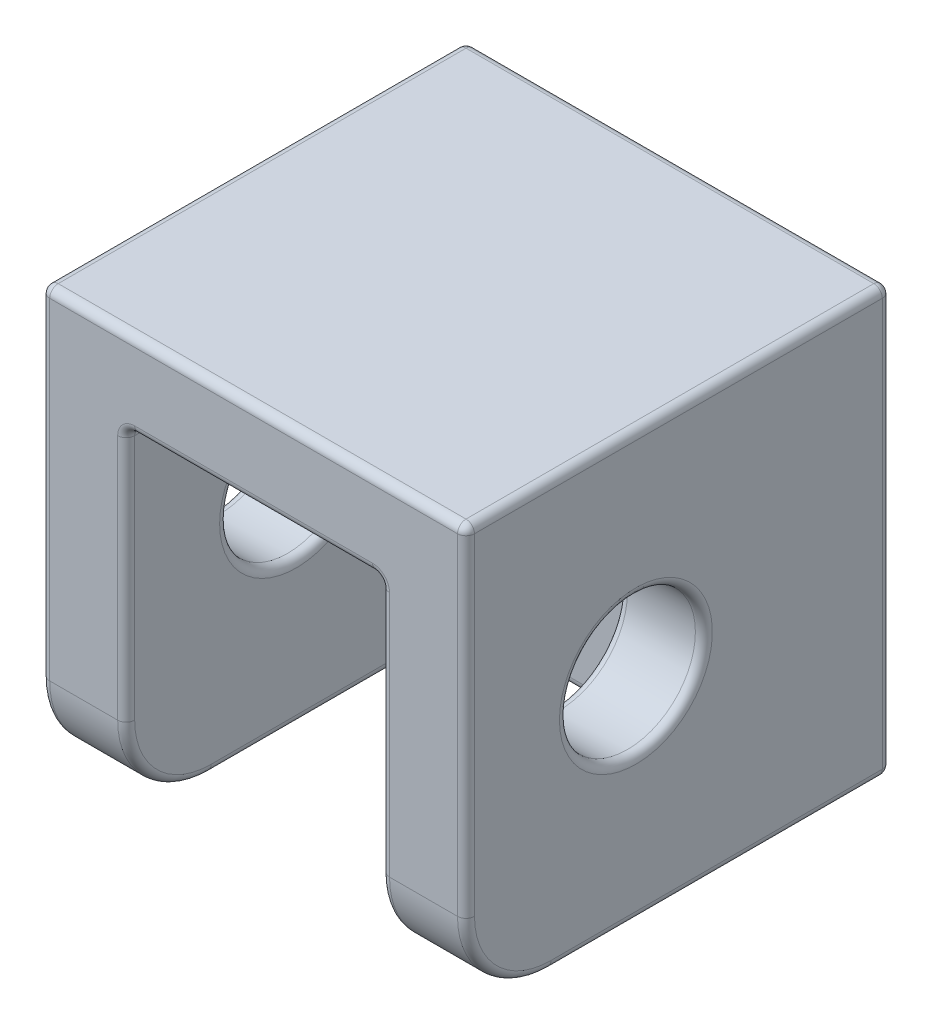
from build123d import *

# Parameters (mm, degrees)
SKETCH1_W           = 50
SKETCH1_H           = 50
BOSS_EXTRUDE1_DEPTH = 50
SKETCH2_W           = 30
SKETCH2_H           = 40
CUT_EXTRUDE1_DEPTH  = 40
SKETCH3_R           = 8
CUT_EXTRUDE3_DEPTH  = 90
SKETCH4_R           = 10.5
CUT_EXTRUDE5_DEPTH  = 90
FILLET2_R           = 10
FILLET3_R           = 1
FILLET4_R           = 1


with BuildPart() as part:
    # Sketch1 → Boss-Extrude1 (new body)
    with BuildSketch(Plane.XY):
        Rectangle(SKETCH1_W, SKETCH1_H)
    extrude(amount=BOSS_EXTRUDE1_DEPTH)

    # Sketch2 → Cut-Extrude1 (cut)
    with BuildSketch(Plane.XY.offset(50)):
        with Locations((0, -5)):
            Rectangle(SKETCH2_W, SKETCH2_H)
    extrude(amount=-CUT_EXTRUDE1_DEPTH, mode=Mode.SUBTRACT)

    # Sketch3 → Cut-Extrude3 (cut)
    with BuildSketch(Plane(origin=(25, 0, 0), x_dir=(0, 0, -1), z_dir=(1, 0, 0))):
        with Locations((-30, 0)):
            Circle(SKETCH3_R)
    extrude(amount=-CUT_EXTRUDE3_DEPTH, mode=Mode.SUBTRACT)

    # Sketch4 → Cut-Extrude5 (cut)
    with BuildSketch(Plane(origin=(0, 0, 0), x_dir=(-1, 0, 0), z_dir=(0, 0, -1))):
        Circle(SKETCH4_R)
    extrude(amount=-CUT_EXTRUDE5_DEPTH, mode=Mode.SUBTRACT)

    # Fillet2
    fillet2_edges = [part.edges().sort_by_distance(p)[0] for p in [
        (20, -25, 50),
        (-20, -25, 50),
    ]]
    fillet(fillet2_edges, radius=FILLET2_R)

    # Fillet3
    fillet3_edges = [part.edges().sort_by_distance(p)[0] for p in [
        (-25, 5, 50),
        (-15, -5, 10),
        (-15, -25, 25),
        (0, 15, 10),
        (-15, 15, 30),
        (15, -5, 10),
        (15, 15, 30),
        (0, -25, 10),
        (15, -25, 25),
        (-15, 0, 50),
        (0, 15, 50),
        (15, 0, 50),
        (25, 5, 50),
        (25, -25, 20),
        (25, -22.071067812, 47.071067812),
        (-25, -25, 20),
        (15, -22.071067812, 47.071067812),
        (-15, -22.071067812, 47.071067812),
        (-25, -22.071067812, 47.071067812),
        (0, -25, 0),
        (-25, 0, 0),
        (0, 25, 0),
        (25, 0, 0),
        (-25, 25, 25),
        (25, 25, 25),
        (0, 25, 50),
    ]]
    fillet(fillet3_edges, radius=FILLET3_R)

    # Fillet4
    fillet4_edges = [part.edges().sort_by_distance(p)[0] for p in [
        (-15, 0, 38),
        (-25, 0, 38),
        (15, 0, 38),
        (25, 0, 38),
    ]]
    fillet(fillet4_edges, radius=FILLET4_R)


solid = part.part
